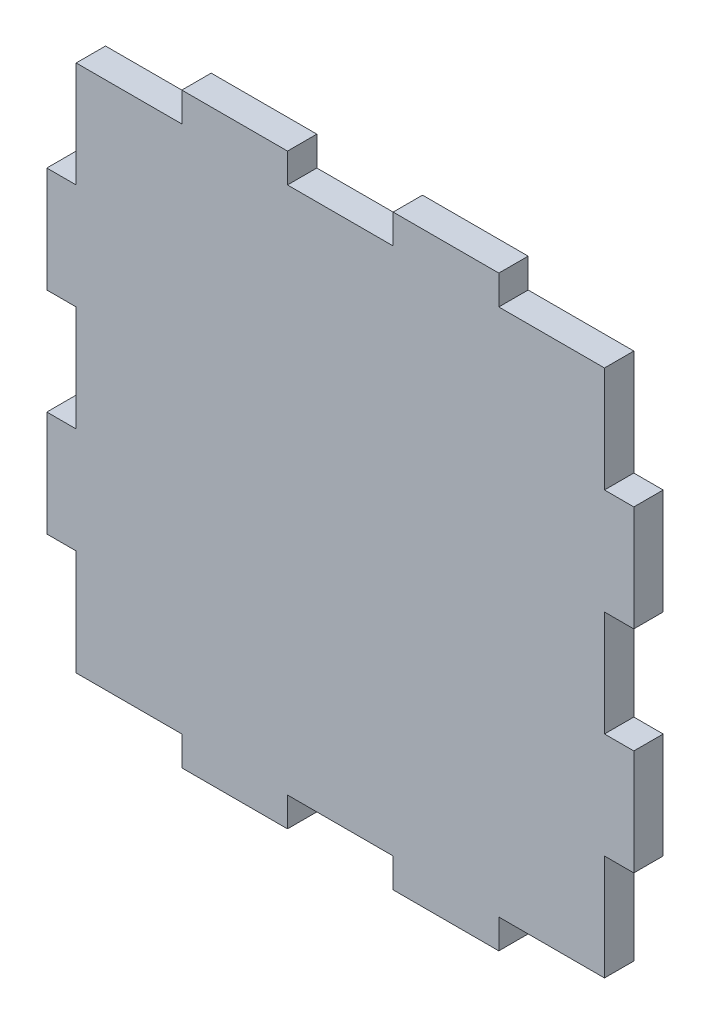
from build123d import *

# Parameters (mm, degrees)
ESQUISSE1_W        = 90
ESQUISSE1_H        = 90
BOSS_EXTRU_1_DEPTH = 5
ESQUISSE2_W        = 5
ESQUISSE2_H        = 18
BOSS_EXTRU_2_DEPTH = 5
ESQUISSE3_W        = 18
ESQUISSE3_H        = 5
BOSS_EXTRU_3_DEPTH = 5


with BuildPart() as part:
    # Esquisse1 → Boss.-Extru.1 (new body)
    with BuildSketch(Plane.XY):
        with Locations((-45, -45)):
            Rectangle(ESQUISSE1_W, ESQUISSE1_H)
    extrude(amount=BOSS_EXTRU_1_DEPTH)

    # Esquisse2 → Boss.-Extru.2 (add)
    with BuildSketch(Plane(origin=(0, 0, 0), x_dir=(-1, 0, 0), z_dir=(0, 0, -1))):
        with Locations((-2.5, -27)):
            Rectangle(ESQUISSE2_W, ESQUISSE2_H)
        with Locations((-2.5, -63)):
            Rectangle(ESQUISSE2_W, ESQUISSE2_H)
        with Locations((92.5, -63)):
            Rectangle(ESQUISSE2_W, ESQUISSE2_H)
        with Locations((92.5, -27)):
            Rectangle(ESQUISSE2_W, ESQUISSE2_H)
    extrude(amount=-BOSS_EXTRU_2_DEPTH)

    # Esquisse3 → Boss.-Extru.3 (add)
    with BuildSketch(Plane(origin=(0, 0, 0), x_dir=(-1, 0, 0), z_dir=(0, 0, -1))):
        with Locations((27, 2.5)):
            Rectangle(ESQUISSE3_W, ESQUISSE3_H)
        with Locations((63, 2.5)):
            Rectangle(ESQUISSE3_W, ESQUISSE3_H)
        with Locations((63, -92.5)):
            Rectangle(ESQUISSE3_W, ESQUISSE3_H)
        with Locations((27, -92.5)):
            Rectangle(ESQUISSE3_W, ESQUISSE3_H)
    extrude(amount=-BOSS_EXTRU_3_DEPTH)


solid = part.part
